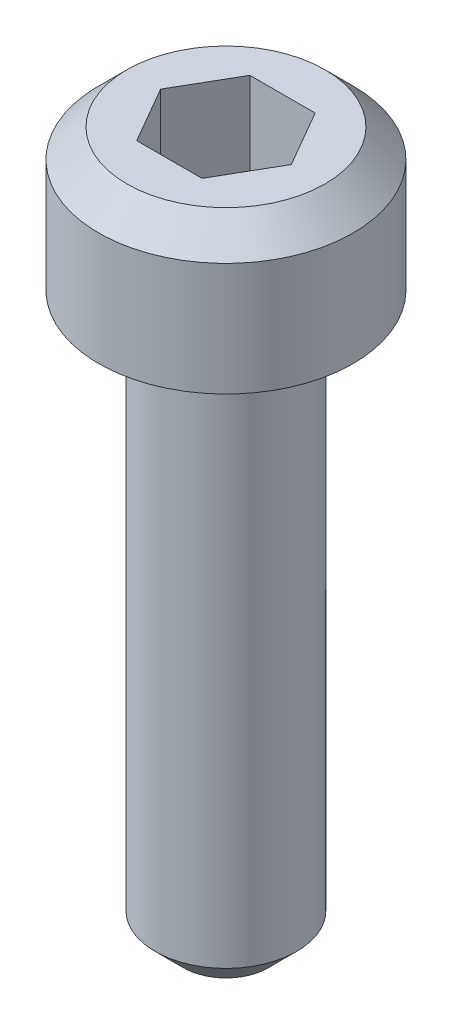
from build123d import *

# Parameters (mm, degrees)
CUT_EXTRUDE1_DEPTH = 1.5


with BuildPart() as part:
    # Sketch1 → Revolve1 (revolve)
    with BuildSketch(Plane.XY, mode=Mode.PRIVATE) as revolve1_sk:
        Polygon((0, 12.5), (-1.75, 12.5), (-2.25, 12), (-2.25, 10), (-1.25, 10), (-1.25, 0.5), (-0.75, 0), (0, 0), align=None)
    revolve(revolve1_sk.sketch.rotate(Axis((0, 0, 0), (0, 1, 0)), 270), axis=Axis((0, 0, 0), (0, 1, 0)))

    # Sketch2 → Cut-Extrude1 (cut)
    with BuildSketch(Plane(origin=(0, 12.5, 0), x_dir=(1, 0, 0), z_dir=(0, 1, 0))):
        Polygon((-1.154700538, 0), (-0.577350269, -1), (0.577350269, -1), (1.154700538, 0), (0.577350269, 1), (-0.577350269, 1), align=None)
    extrude(amount=-CUT_EXTRUDE1_DEPTH, mode=Mode.SUBTRACT)


solid = part.part
